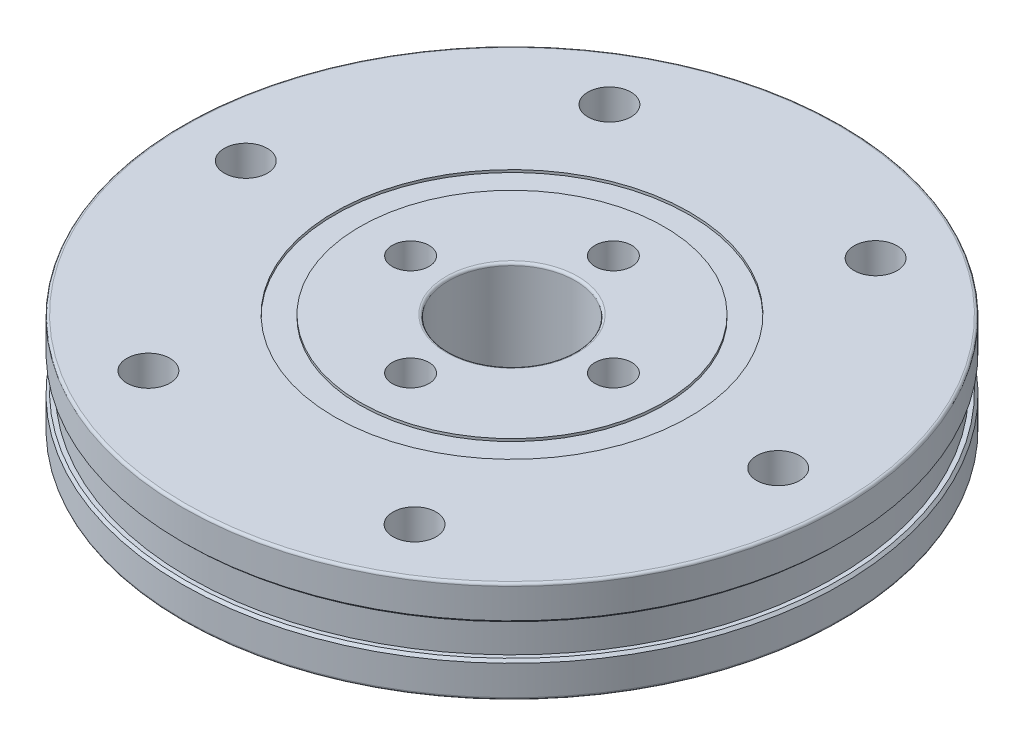
from build123d import *

# Parameters (mm, degrees)
SKETCH_1_R          = 26
SKETCH_1_R_2        = 5
SKETCH_1_R_3        = 1.7
SKETCH_1_R_4        = 1.45
EXTRUDE_1_DEPTH     = 4
SKETCH_2_R          = 14
SKETCH_2_R_2        = 12
CUT_EXTRUDE_1_DEPTH = 0.2
CUT_EXTRUDE_START   = -0.2
SKETCH_3_R          = 14
SKETCH_3_R_2        = 12
CUT_EXTRUDE_2_DEPTH = 0.2
SKETCH_5_R          = 27.923918385
SKETCH_5_R_2        = 25.46843451
CUT_EXTRUDE_3_DEPTH = 1.25
CHAMFER_1_SIZE      = 0.2
FILLET_1_R          = 0.2
SKETCH_6_R          = 3.25
CUT_EXTRUDE_4_DEPTH = 3.3


with BuildPart() as part:
    # 草图1 → 凸台-拉伸1 (new, symmetric)
    with BuildSketch(Plane(origin=(0, 0, 0), x_dir=(1, 0, 0), z_dir=(0, 1, 0))):
        with Locations(Location((0, 0, 0), (0, 0, 270))):
            Circle(SKETCH_1_R)
        with Locations(Location((0, 0, 0), (0, 0, 270))):
            Circle(SKETCH_1_R_2, mode=Mode.SUBTRACT)
        with Locations(Location((-10.5, 18.186533479, 0), (0, 0, 270))):
            Circle(SKETCH_1_R_3, mode=Mode.SUBTRACT)
        with Locations(Location((10.5, 18.186533479, 0), (0, 0, 270))):
            Circle(SKETCH_1_R_3, mode=Mode.SUBTRACT)
        with Locations(Location((21, 0, 0), (0, 0, 270))):
            Circle(SKETCH_1_R_3, mode=Mode.SUBTRACT)
        with Locations(Location((10.5, -18.186533479, 0), (0, 0, 270))):
            Circle(SKETCH_1_R_3, mode=Mode.SUBTRACT)
        with Locations(Location((-10.5, -18.186533479, 0), (0, 0, 270))):
            Circle(SKETCH_1_R_3, mode=Mode.SUBTRACT)
        with Locations(Location((-21, 0, 0), (0, 0, 270))):
            Circle(SKETCH_1_R_3, mode=Mode.SUBTRACT)
        with Locations(Location((0, 8, 0), (0, 0, 270))):
            Circle(SKETCH_1_R_4, mode=Mode.SUBTRACT)
        with Locations(Location((8, 0, 0), (0, 0, 270))):
            Circle(SKETCH_1_R_4, mode=Mode.SUBTRACT)
        with Locations(Location((0, -8, 0), (0, 0, 270))):
            Circle(SKETCH_1_R_4, mode=Mode.SUBTRACT)
        with Locations(Location((-8, 0, 0), (0, 0, 270))):
            Circle(SKETCH_1_R_4, mode=Mode.SUBTRACT)
    extrude(amount=EXTRUDE_1_DEPTH, both=True)

    # 草图2 → 切除-拉伸1 (cut)
    with BuildSketch(Plane(origin=(0, 4, 0), x_dir=(1, 0, 0), z_dir=(0, 1, 0))):
        with Locations(Location((0, 0, 0), (0, 0, 270))):
            Circle(SKETCH_2_R)
        with Locations(Location((0, 0, 0), (0, 0, 270))):
            Circle(SKETCH_2_R_2, mode=Mode.SUBTRACT)
    extrude(amount=-CUT_EXTRUDE_1_DEPTH, mode=Mode.SUBTRACT)

    # 草图3 → 切除-拉伸2 (cut)
    with BuildSketch(Plane.XZ.offset(4).offset(CUT_EXTRUDE_START)):
        with Locations(Location((0, 0, 0), (0, 0, 90))):
            Circle(SKETCH_3_R)
        with Locations(Location((0, 0, 0), (0, 0, 90))):
            Circle(SKETCH_3_R_2, mode=Mode.SUBTRACT)
    extrude(amount=CUT_EXTRUDE_2_DEPTH, mode=Mode.SUBTRACT)

    # 草图5 → 切除-拉伸3 (cut, symmetric)
    with BuildSketch(Plane(origin=(0, 0, 0), x_dir=(1, 0, 0), z_dir=(0, 1, 0))):
        Circle(SKETCH_5_R)
        with Locations(Location((0, 0, 0), (0, 0, 270))):
            Circle(SKETCH_5_R_2, mode=Mode.SUBTRACT)
    extrude(amount=CUT_EXTRUDE_3_DEPTH, both=True, mode=Mode.SUBTRACT)

    # 倒角1
    chamfer_1_edges = [part.edges().sort_by_distance(p)[0] for p in [
        (0, 1.25, -26),
        (0, -1.25, -26),
    ]]
    chamfer(chamfer_1_edges, length=CHAMFER_1_SIZE)

    # 圆角1
    fillet_1_edges = [part.edges().sort_by_distance(p)[0] for p in [
        (0, -4, -26),
        (0, 4, -26),
        (0, -4, -5),
        (0, 4, -5),
    ]]
    fillet(fillet_1_edges, radius=FILLET_1_R)

    # 草图6 → 切除-拉伸4 (cut)
    with BuildSketch(Plane.XZ.offset(4)):
        with Locations(Location((-21, 0, 0), (0, 0, 270))):
            Circle(SKETCH_6_R)
        with Locations(Location((-10.5, -18.186533479, 0), (0, 0, 270))):
            Circle(SKETCH_6_R)
        with Locations(Location((10.5, -18.186533479, 0), (0, 0, 270))):
            Circle(SKETCH_6_R)
        with Locations(Location((21, 0, 0), (0, 0, 270))):
            Circle(SKETCH_6_R)
        with Locations(Location((10.5, 18.186533479, 0), (0, 0, 270))):
            Circle(SKETCH_6_R)
        with Locations(Location((-10.5, 18.186533479, 0), (0, 0, 270))):
            Circle(SKETCH_6_R)
    extrude(amount=-CUT_EXTRUDE_4_DEPTH, mode=Mode.SUBTRACT)


solid = part.part
